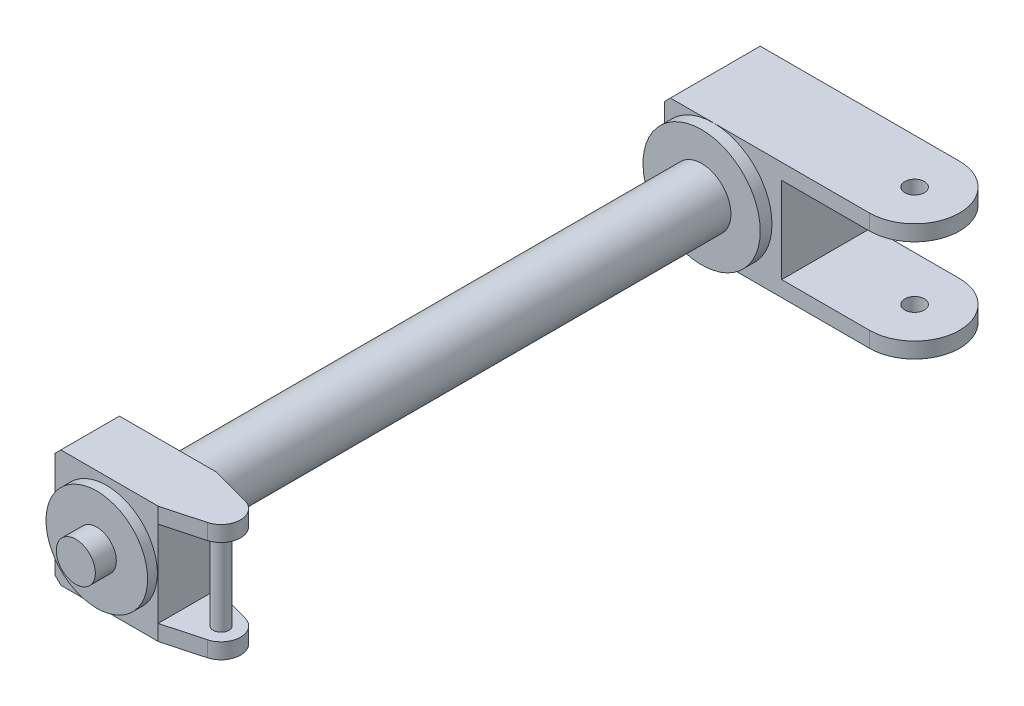
from build123d import *

# Parameters (mm, degrees)
SALIENTE_EXTRUIR1_DEPTH = 60
CROQUIS5_W              = 68
CROQUIS5_H              = 44
CORTAR_EXTRUIR1_DEPTH   = 128.769323392
CHAFL_N1_SIZE           = 3
CROQUIS6_R              = 30
SALIENTE_EXTRUIR4_DEPTH = 6
CROQUIS7_R              = 15
SALIENTE_EXTRUIR5_DEPTH = 276
SALIENTE_EXTRUIR6_DEPTH = 30
CORTAR_EXTRUIR2_REACH   = 379.323
CROQUIS9_W              = 27.2
CROQUIS9_H              = 44
CORTAR_EXTRUIR3_DEPTH   = 60
SALIENTE_EXTRUIR7_REACH = 356.313
CROQUIS11_R             = 4
CROQUIS13_R             = 26
SALIENTE_EXTRUIR8_DEPTH = 5
CROQUIS14_R             = 10
SALIENTE_EXTRUIR9_DEPTH = 10.75
CROQUIS15_R             = 5
CORTAR_EXTRUIR4_DEPTH   = 371.451835601


with BuildPart() as part:
    # Croquis2 → Saliente-Extruir1 (new body)
    with BuildSketch(Plane(origin=(0, 0, 0), x_dir=(1, 0, 0), z_dir=(0, 1, 0))):
        with BuildLine():
            Line((-25, -23), (-25, 23))
            Line((-25, 23), (80, 23))
            ThreePointArc((80, 23), (103, 0), (80, -23))
            Line((80, -23), (-25, -23))
        make_face()
    extrude(amount=SALIENTE_EXTRUIR1_DEPTH)

    # Croquis5 → Cortar-Extruir1 (cut, through all)
    with BuildSketch(Plane.XY.offset(23)):
        with Locations((69, 30)):
            Rectangle(CROQUIS5_W, CROQUIS5_H)
    extrude(amount=-CORTAR_EXTRUIR1_DEPTH, mode=Mode.SUBTRACT)

    # Chaflán1
    chafl_n1_edges = [part.edges().sort_by_distance(p)[0] for p in [
        (-25, 60, 0),
        (-25, 0, 0),
    ]]
    chamfer(chafl_n1_edges, length=CHAFL_N1_SIZE)

    # Croquis6 → Saliente-Extruir4 (add)
    with BuildSketch(Plane.XY.offset(23)):
        with Locations(Location((0, 30, 0), (0, 0, 146.442690238))):
            Circle(CROQUIS6_R)
    extrude(amount=SALIENTE_EXTRUIR4_DEPTH)

    # Croquis7 → Saliente-Extruir5 (add)
    with BuildSketch(Plane.XY.offset(29)):
        with Locations((0, 30)):
            Circle(CROQUIS7_R)
    extrude(amount=SALIENTE_EXTRUIR5_DEPTH)

    # Croquis8 → Saliente-Extruir6 (add)
    with BuildSketch(Plane.XY.offset(305)):
        Polygon((-22, 60), (55, 60), (55, 0), (-22, 0), (-25, 3), (-25, 57), align=None)
    extrude(amount=SALIENTE_EXTRUIR6_DEPTH)

    # Croquis9 → Cortar-Extruir2 (cut, up to next)
    with BuildSketch(Plane.XY.offset(335), mode=Mode.PRIVATE) as cortar_extruir2_sk1:
        with Locations((41.4, 30)):
            Rectangle(CROQUIS9_W, CROQUIS9_H)
    cortar_extruir2_tool1 = extrude(cortar_extruir2_sk1.sketch, amount=-CORTAR_EXTRUIR2_REACH, mode=Mode.PRIVATE) & part.part
    add(cortar_extruir2_tool1.solids().sort_by_distance((41.4, 30, 335))[0], mode=Mode.SUBTRACT)

    # Croquis10 → Cortar-Extruir3 (cut)
    with BuildSketch(Plane.XZ):
        with BuildLine():
            Line((55, 335), (27.8, 335))
            Line((27.8, 335), (47.605709584, 329.654546989))
            ThreePointArc((47.605709584, 329.654546989), (52.939052079, 326.080415453), (55, 320))
            Line((55, 320), (55, 335))
        make_face()
        with BuildLine():
            Line((55, 305), (55, 320))
            ThreePointArc((55, 320), (52.939052079, 313.919584547), (47.605709584, 310.345453011))
            Line((47.605709584, 310.345453011), (27.8, 305))
            Line((27.8, 305), (55, 305))
        make_face()
    extrude(amount=-CORTAR_EXTRUIR3_DEPTH, mode=Mode.SUBTRACT)

    # Croquis11 → Saliente-Extruir7 (add, up to next)
    with BuildSketch(Plane.XZ.offset(-52), mode=Mode.PRIVATE) as saliente_extruir7_sk1:
        with Locations(Location((45, 320, 0), (0, 0, 90))):
            Circle(CROQUIS11_R)
    saliente_extruir7_tool1 = extrude(saliente_extruir7_sk1.sketch, amount=SALIENTE_EXTRUIR7_REACH, mode=Mode.PRIVATE) - part.part
    add(saliente_extruir7_tool1.solids().sort_by_distance((45, 52, 320))[0])

    # Croquis13 → Saliente-Extruir8 (add)
    with BuildSketch(Plane.XY.offset(335)):
        with Locations(Location((1.4, 30, 0), (0, 0, 180))):
            Circle(CROQUIS13_R)
    extrude(amount=SALIENTE_EXTRUIR8_DEPTH)

    # Croquis14 → Saliente-Extruir9 (add)
    with BuildSketch(Plane.XY.offset(340)):
        with Locations((1.4, 30)):
            Circle(CROQUIS14_R)
    extrude(amount=SALIENTE_EXTRUIR9_DEPTH)

    # Croquis15 → Cortar-Extruir4 (cut, through all)
    with BuildSketch(Plane.XZ):
        with Locations(Location((80, 0, 0), (0, 0, 270))):
            Circle(CROQUIS15_R)
    extrude(amount=-CORTAR_EXTRUIR4_DEPTH, mode=Mode.SUBTRACT)


solid = part.part
